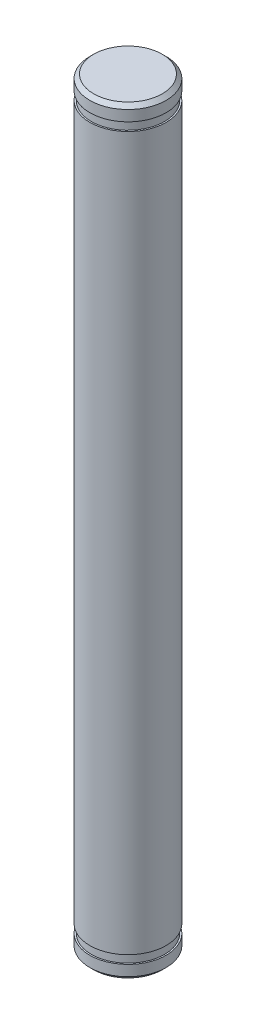
from build123d import *

# Parameters (mm, degrees)
SKETCH_1_R          = 5
EXTRUDE_1_DEPTH     = 99.5
CHAMFER_1_SIZE      = 0.5
CUT_EXTRUDE_START   = -3
SKETCH_2_R          = 5
SKETCH_2_R_2        = 4.8
CUT_EXTRUDE_1_DEPTH = 1.1


with BuildPart() as part:
    # 草图1 → 凸台-拉伸1 (new body)
    with BuildSketch(Plane(origin=(0, 0, 0), x_dir=(1, 0, 0), z_dir=(0, 1, 0))):
        with Locations(Location((0, 0, 0), (0, 0, 270))):
            Circle(SKETCH_1_R)
    extrude(amount=EXTRUDE_1_DEPTH)

    # 倒角1
    chamfer_1_edges = [part.edges().sort_by_distance(p)[0] for p in [
        (0, 0, -5),
        (0, 99.5, -5),
    ]]
    chamfer(chamfer_1_edges, length=CHAMFER_1_SIZE)

    # 草图2 → 切除-拉伸1 (cut)
    with BuildSketch(Plane(origin=(0, 99.5, 0), x_dir=(1, 0, 0), z_dir=(0, 1, 0)).offset(CUT_EXTRUDE_START)):
        with Locations(Location((0, 0, 0), (0, 0, 270))):
            Circle(SKETCH_2_R)
        with Locations(Location((0, 0, 0), (0, 0, 270))):
            Circle(SKETCH_2_R_2, mode=Mode.SUBTRACT)
    cut_extrude_1 = extrude(amount=CUT_EXTRUDE_1_DEPTH, mode=Mode.SUBTRACT)

    # 镜向1: 切除-拉伸1 across plane
    add(cut_extrude_1.mirror(Plane.ZX.offset(49.75)), mode=Mode.SUBTRACT)


solid = part.part
